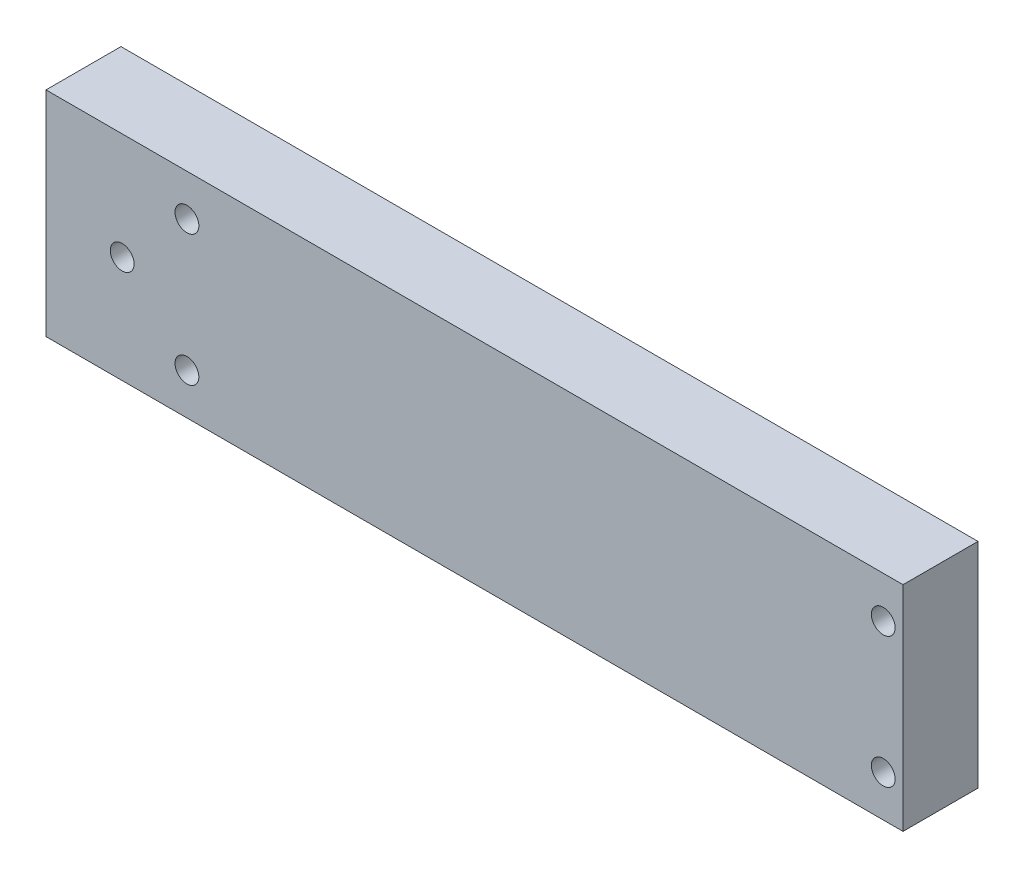
from build123d import *

# Parameters (mm, degrees)
SKETCH_1_W      = 114.3
SKETCH_1_H      = 28.5
EXTRUDE_1_DEPTH = 10
HOLE_WIZARD_1_D = 3.175


with BuildPart() as part:
    # 스케치1 → 보스-돌출1 (new body)
    with BuildSketch(Plane.XY):
        with Locations((57.15, 14.25)):
            Rectangle(SKETCH_1_W, SKETCH_1_H)
    extrude(amount=EXTRUDE_1_DEPTH)

    # 구멍1 (through all)
    with Locations(Plane.XY.offset(10)):
        with Locations((18.796, 22.98125), (111.665004, 22.98125), (10.16, 14.25)):
            hole_wizard_1 = Hole(HOLE_WIZARD_1_D / 2)

    # 대칭 복사1: 구멍1 across plane
    add(hole_wizard_1.mirror(Plane.ZX.offset(14.25)), mode=Mode.SUBTRACT)


solid = part.part
